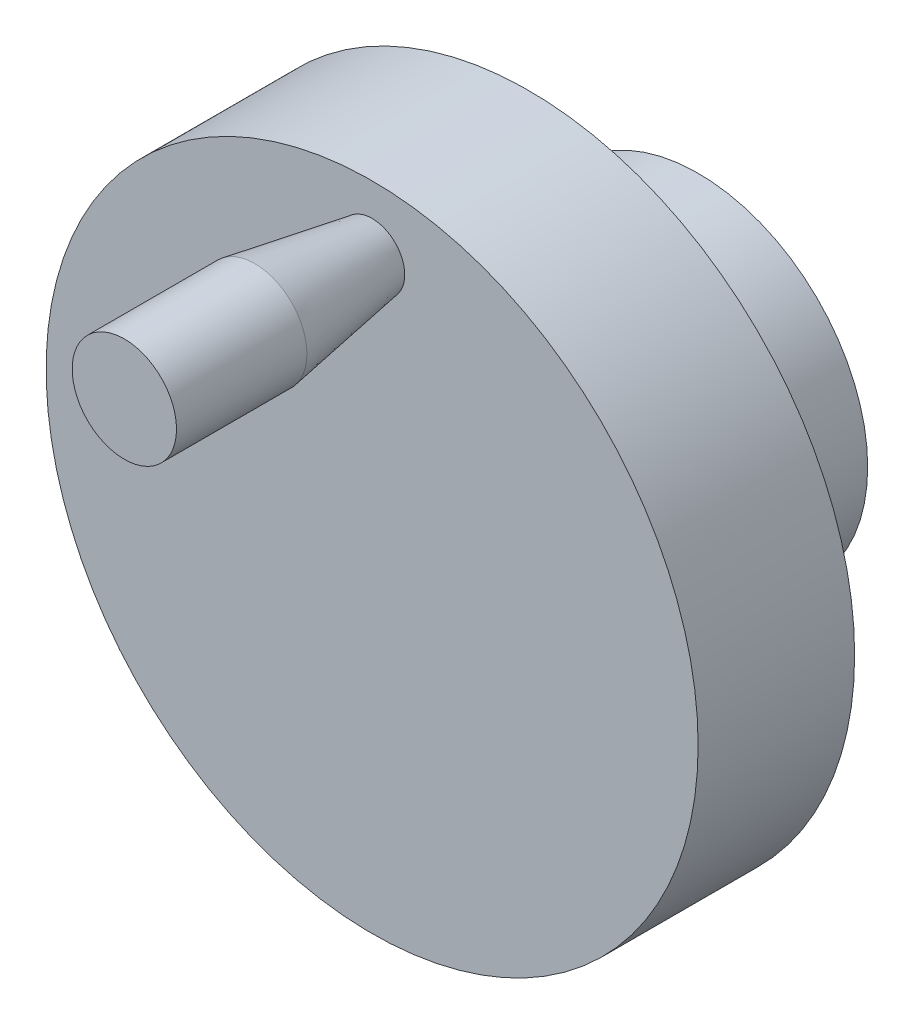
from build123d import *

# Parameters (mm, degrees)
SKETCH_1_R          = 25
EXTRUDE_1_DEPTH     = 12
SKETCH_2_R          = 13
EXTRUDE_2_DEPTH     = 13
SKETCH_3_R          = 4
CUT_EXTRUDE_1_DEPTH = 13


with BuildPart() as part:
    # 草图1 → 凸台-拉伸1 (new body)
    with BuildSketch(Plane.XY):
        Circle(SKETCH_1_R)
    extrude(amount=EXTRUDE_1_DEPTH)

    # 草图2 → 凸台-拉伸2 (add)
    with BuildSketch(Plane(origin=(0, 0, 0), x_dir=(-1, 0, 0), z_dir=(0, 0, -1))):
        with Locations(Location((0, 0, 0), (0, 0, 180))):
            Circle(SKETCH_2_R)
    extrude(amount=EXTRUDE_2_DEPTH)

    # 草图3 → 切除-拉伸1 (cut)
    with BuildSketch(Plane(origin=(0, 0, -13), x_dir=(-1, 0, 0), z_dir=(0, 0, -1))):
        Circle(SKETCH_3_R)
    extrude(amount=-CUT_EXTRUDE_1_DEPTH, mode=Mode.SUBTRACT)

    # 草图4 → 旋转1 (revolve)
    with BuildSketch(Plane(origin=(0, 0, 0), x_dir=(0, 0, -1), z_dir=(1, 0, 0)), mode=Mode.PRIVATE) as revolve_1_sk:
        Polygon((-12, 22.5), (-21, 24), (-31, 24), (-31, 20), (-12, 20), align=None)
    revolve(revolve_1_sk.sketch.rotate(Axis((0, 20, 31), (0, 0, -1)), 90), axis=Axis((0, 20, 31), (0, 0, -1)))


solid = part.part
